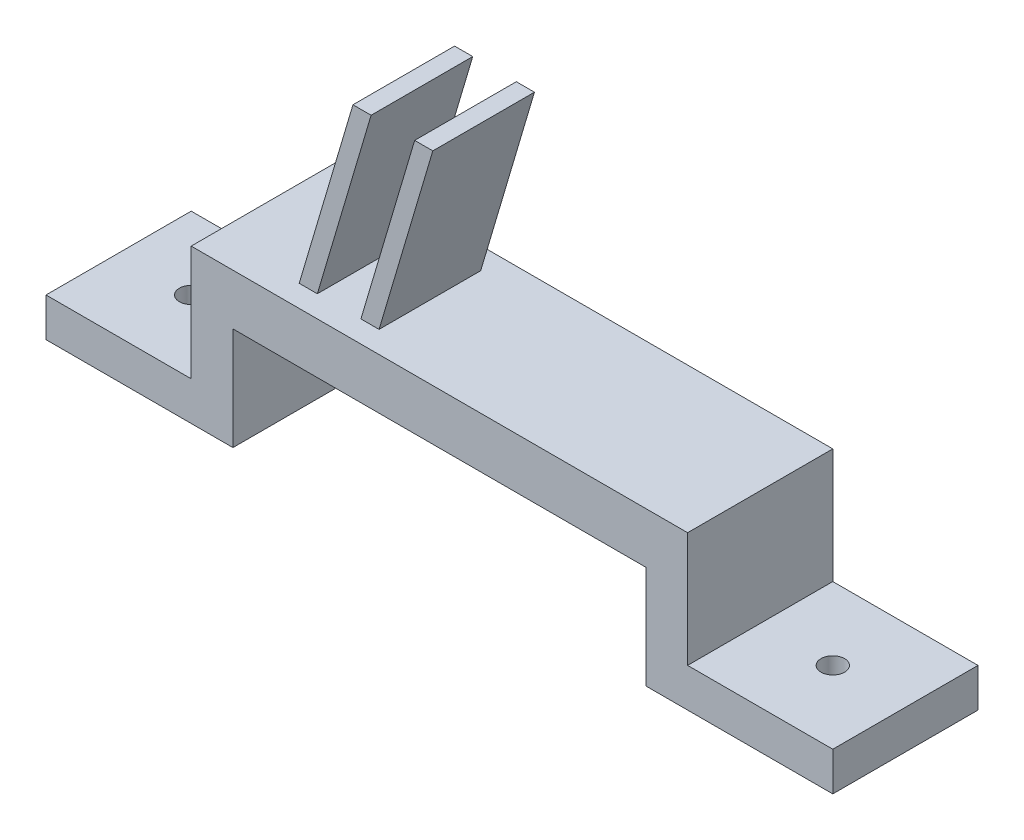
from build123d import *

# Parameters (mm, degrees)
EXTRUDE_1_DEPTH     = 16
SKETCH_3_W          = 16
SKETCH_3_H          = 4.26667426
EXTRUDE_3_DEPTH     = 16
SKETCH_23_W         = 16
SKETCH_23_H         = 4.26667426
EXTRUDE_4_DEPTH     = 16
F_2_0MM_2_D         = 2.6
F_2_0MM_3_D         = 2.6
SKETCH_33_W         = 45.5
SKETCH_33_H         = 16
EXTRUDE_5_DEPTH     = 1
SKETCH_34_W         = 28.538779463
SKETCH_34_H         = 11.2
EXTRUDE_6_DEPTH     = 20
CUT_EXTRUDE_1_DEPTH = 20


with BuildPart() as part:
    # 草图2 → 凸台-拉伸1 (new body)
    with BuildSketch(Plane.XY):
        Polygon((34.591799544, 12.66332574), (-20.108200456, 12.66332574), (-20.108200456, -4.26667426), (-15.508200456, -4.26667426), (-15.508200456, 8.06332574), (29.991799544, 8.06332574), (29.991799544, -4.26667426), (34.591799544, -4.26667426), align=None)
    extrude(amount=EXTRUDE_1_DEPTH)

    # 草图3 → 凸台-拉伸3 (add)
    with BuildSketch(Plane.ZY.offset(20.108200456)):
        with Locations((8, -2.13333713)):
            Rectangle(SKETCH_3_W, SKETCH_3_H)
    extrude(amount=EXTRUDE_3_DEPTH)

    # 草图23 → 凸台-拉伸4 (add)
    with BuildSketch(Plane(origin=(34.591799544, 0, 0), x_dir=(0, 0, -1), z_dir=(1, 0, 0))):
        with Locations((-8, -2.13333713)):
            Rectangle(SKETCH_23_W, SKETCH_23_H)
    extrude(amount=EXTRUDE_4_DEPTH)

    # Ø2.0mm 暗销孔2 (through all)
    with Locations(Plane(origin=(0, 0, 0), x_dir=(1, 0, 0), z_dir=(0, 1, 0))):
        with Locations((42.591799544, -8)):
            Hole(F_2_0MM_2_D / 2)

    # Ø2.0mm 暗销孔3 (through all)
    with Locations(Plane(origin=(0, 0, 0), x_dir=(1, 0, 0), z_dir=(0, 1, 0))):
        with Locations((-28.108200456, -8)):
            Hole(F_2_0MM_3_D / 2)

    # 草图33 → 凸台-拉伸5 (add)
    with BuildSketch(Plane.XZ.offset(-8.06332574)):
        with Locations((7.241799544, 8)):
            Rectangle(SKETCH_33_W, SKETCH_33_H)
    extrude(amount=EXTRUDE_5_DEPTH)

    # 草图34 → 凸台-拉伸6 (add)
    with BuildSketch(Plane(origin=(0, 12.66332574, 0), x_dir=(1, 0, 0), z_dir=(0, 1, 0))):
        with Locations((-5.838810725, -8)):
            Rectangle(SKETCH_34_W, SKETCH_34_H)
    extrude(amount=EXTRUDE_6_DEPTH)

    # 草图35 → 切除-拉伸1 (cut)
    with BuildSketch(Plane.XY.offset(16)):
        Polygon((-3.808200456, 12.66332574), (2.116069444, 32.66332574), (-2.683930556, 32.66332574), (-8.608200456, 12.66332574), align=None)
        Polygon((-1.808200456, 12.66332574), (8.430579007, 12.66332574), (8.430579007, 32.66332574), (4.116069444, 32.66332574), align=None)
        Polygon((-20.108200456, 12.66332574), (-10.608200456, 12.66332574), (-4.683930556, 32.66332574), (-20.108200456, 32.66332574), align=None)
    extrude(amount=-CUT_EXTRUDE_1_DEPTH, mode=Mode.SUBTRACT)


solid = part.part
